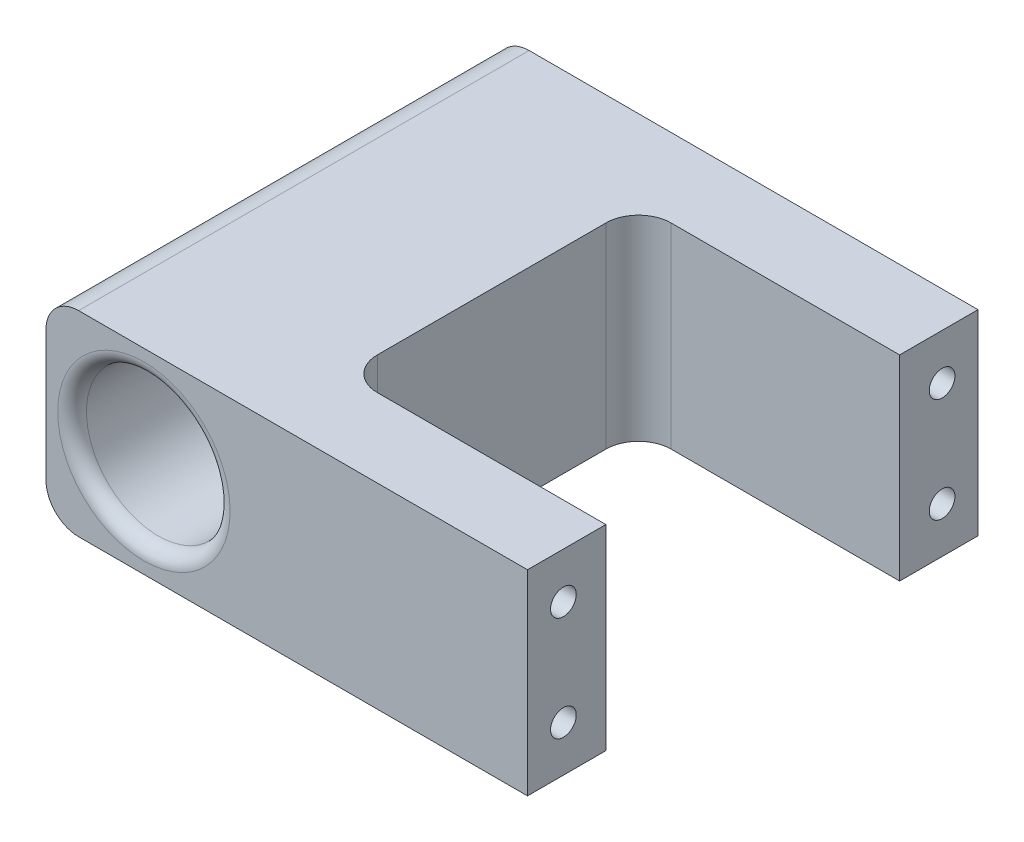
from build123d import *

# Parameters (mm, degrees)
SKETCH1_R                 = 13.97
BOSS_EXTRUDE1_DEPTH       = 87.63
FILLET3_R                 = 2.794
M6X1_0_TAPPED_HOLE1_D     = 5
M6X1_0_TAPPED_HOLE1_DEPTH = 41.148
M6X1_0_TAPPED_HOLE1_TIP   = 1.502151548
CUT_EXTRUDE1_DEPTH        = 50.8
FILLET4_R                 = 6.35
FILLET5_R                 = 6.35


with BuildPart() as part:
    # Sketch1 → Boss-Extrude1 (new body)
    with BuildSketch(Plane.XY):
        Polygon((74.609999878, 19.05), (0, 19.05), (-19.05, 19.05), (-19.05, -19.05), (0, -19.05), (74.609999878, -19.05), align=None)
        Circle(SKETCH1_R, mode=Mode.SUBTRACT)
    extrude(amount=BOSS_EXTRUDE1_DEPTH)

    # Fillet3
    fillet3_edges = [part.edges().sort_by_distance(p)[0] for p in [
        (-13.97, 0, 0),
        (-13.97, 0, 87.63),
    ]]
    fillet(fillet3_edges, radius=FILLET3_R)

    # M6x1.0 Tapped Hole1
    with Locations(Plane(origin=(74.609999878, 0, 0), x_dir=(0, 0, -1), z_dir=(1, 0, 0))):
        with Locations((-80.645, -10.16), (-80.645, 10.16), (-6.985, 10.16), (-6.985, -10.16)):
            Hole(M6X1_0_TAPPED_HOLE1_D / 2, depth=M6X1_0_TAPPED_HOLE1_DEPTH)
            with Locations((0, 0, -(M6X1_0_TAPPED_HOLE1_DEPTH + M6X1_0_TAPPED_HOLE1_TIP / 2))):  # 118° drill point
                Cone(0, M6X1_0_TAPPED_HOLE1_D / 2, M6X1_0_TAPPED_HOLE1_TIP, mode=Mode.SUBTRACT)

    # Sketch16 → Cut-Extrude1 (cut)
    with BuildSketch(Plane(origin=(74.609999878, 0, 0), x_dir=(0, 0, -1), z_dir=(1, 0, 0))):
        Polygon((-15.24, 19.05), (-15.24, -19.05), (-72.39, -19.05), (-72.39, 19.05), (-43.815, 19.05), align=None)
    extrude(amount=-CUT_EXTRUDE1_DEPTH, mode=Mode.SUBTRACT)

    # Fillet4
    fillet4_edges = [part.edges().sort_by_distance(p)[0] for p in [
        (23.809999878, 0, 15.24),
        (23.809999878, 0, 72.39),
    ]]
    fillet(fillet4_edges, radius=FILLET4_R)

    # Fillet5
    fillet5_edges = [part.edges().sort_by_distance(p)[0] for p in [
        (-19.05, -19.05, 43.815),
        (-19.05, 19.05, 43.815),
    ]]
    fillet(fillet5_edges, radius=FILLET5_R)


solid = part.part
